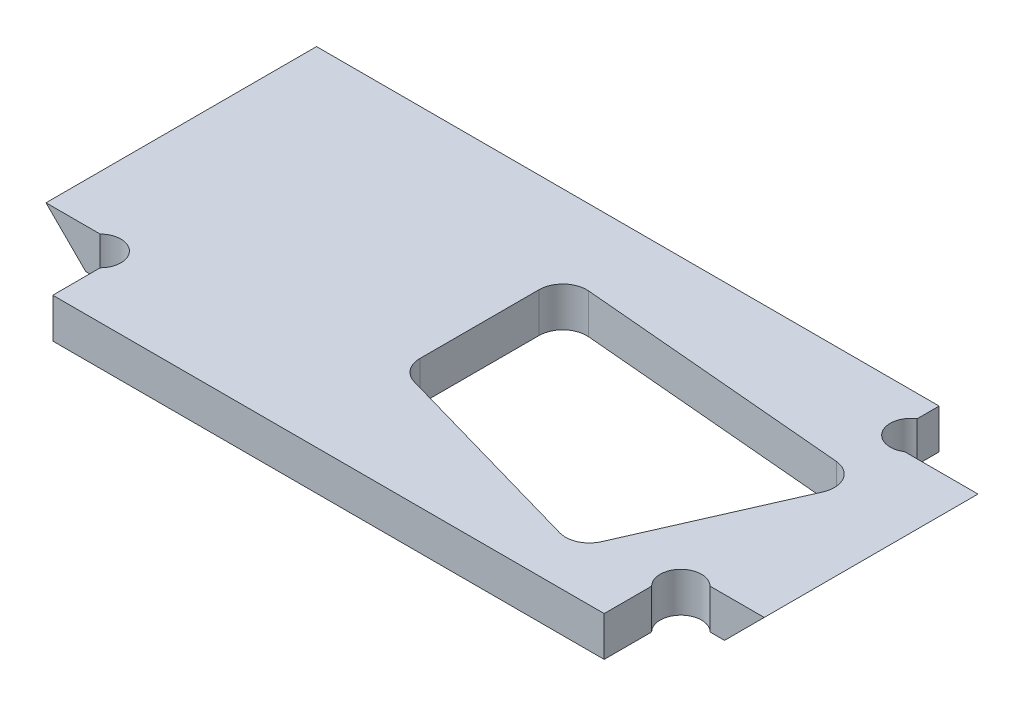
from build123d import *

# Parameters (mm, degrees)
SKETCH1_W           = 229.616
SKETCH1_H           = 110.998
BOSS_EXTRUDE1_DEPTH = 12.7
DRAFT1_ANGLE        = -45
CUT_EXTRUDE1_DEPTH  = 139.893248743
CUT_EXTRUDE2_DEPTH  = 139.893248743


with BuildPart() as part:
    # Sketch1 → Boss-Extrude1 (new body)
    with BuildSketch(Plane(origin=(0, 0, 0), x_dir=(1, 0, 0), z_dir=(0, 1, 0))):
        with Locations((0, 21.631847801)):
            Rectangle(SKETCH1_W, SKETCH1_H)
    extrude(amount=BOSS_EXTRUDE1_DEPTH)

    # Draft1
    draft1_faces = [part.faces().sort_by_distance(p)[0] for p in [
        (-114.808, 6.35, -21.631847801),
        (114.808, 6.35, -21.631847801),
    ]]
    draft(draft1_faces, Plane.ZX.offset(12.7), DRAFT1_ANGLE)

    # Sketch2 → Cut-Extrude1 (cut, through all)
    with BuildSketch(Plane(origin=(0, 12.7, 0), x_dir=(1, 0, 0), z_dir=(0, 1, 0))):
        with BuildLine():
            Line((-114.808, -9.356152199), (-97.477466366, -9.356152199))
            ThreePointArc((-97.477466366, -9.356152199), (-88.138, -9.356152199), (-88.138, -18.695618565))
            Line((-88.138, -18.695618565), (-88.138, -33.867152199))
            Line((-88.138, -33.867152199), (-114.808, -33.867152199))
            Line((-114.808, -33.867152199), (-114.808, -9.356152199))
        make_face()
        with BuildLine():
            Line((114.808, -33.867152199), (114.808, -9.356152199))
            Line((114.808, -9.356152199), (97.477466366, -9.356152199))
            ThreePointArc((97.477466366, -9.356152199), (88.138, -9.356152199), (88.138, -18.695618565))
            Line((88.138, -18.695618565), (88.138, -33.867152199))
            Line((88.138, -33.867152199), (114.808, -33.867152199))
        make_face()
        with BuildLine():
            Line((84.224585113, 77.130847801), (114.808, 77.130847801))
            Line((114.808, 77.130847801), (114.808, 58.969847801))
            Line((114.808, 58.969847801), (91.336585113, 58.969847801))
            ThreePointArc((91.336585113, 58.969847801), (82.215723928, 60.978708985), (84.224585113, 70.099570169))
            Line((84.224585113, 70.099570169), (84.224585113, 77.130847801))
        make_face()
    extrude(amount=-CUT_EXTRUDE1_DEPTH, mode=Mode.SUBTRACT)

    # Sketch3 → Cut-Extrude2 (cut, through all)
    with BuildSketch(Plane(origin=(0, 12.7, 0), x_dir=(1, 0, 0), z_dir=(0, 1, 0))):
        with BuildLine():
            Line((-3.65376202, 52.971841669), (83.097055719, 45.380847801))
            ThreePointArc((83.097055719, 45.380847801), (88.989685458, 41.672106593), (89.408, 34.722080728))
            Line((89.408, 34.722080728), (67.818, -14.367006033))
            ThreePointArc((67.818, -14.367006033), (64.083911918, -18.195587555), (58.753320746, -18.627152199))
            Line((58.753320746, -18.627152199), (-6.407496993, -0.047071571))
            ThreePointArc((-6.407496993, -0.047071571), (-10.400202195, 2.69050833), (-11.938, 7.280847801))
            Line((-11.938, 7.280847801), (-11.938, 45.380847801))
            ThreePointArc((-11.938, 45.380847801), (-9.465956225, 50.99893882), (-3.65376202, 52.971841669))
        make_face()
    extrude(amount=-CUT_EXTRUDE2_DEPTH, mode=Mode.SUBTRACT)


solid = part.part
